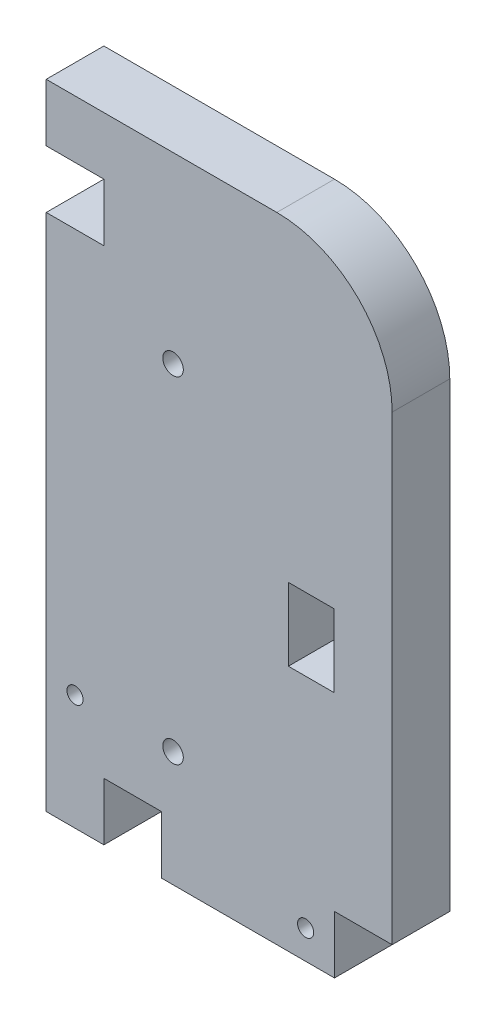
from build123d import *

# Parameters (mm, degrees)
SKETCH1_R           = 1.1303
SKETCH1_R_2         = 0.889
SKETCH1_W           = 5
SKETCH1_H           = 8.000000002
BOSS_EXTRUDE1_DEPTH = 6.35


with BuildPart() as part:
    # Sketch1 → Boss-Extrude1 (new body)
    with BuildSketch(Plane.XY):
        with BuildLine():
            Line((-16.134535362, 9.317270845), (-16.134535362, -47.832729155))
            Line((-16.134535362, -47.832729155), (-9.784535362, -47.832729155))
            Line((-9.784535362, -47.832729155), (-9.784535362, -41.482729155))
            Line((-9.784535362, -41.482729155), (-3.434535362, -41.482729155))
            Line((-3.434535362, -41.482729155), (-3.434535362, -47.832729155))
            Line((-3.434535362, -47.832729155), (15.615464638, -47.832729155))
            Line((15.615464638, -47.832729155), (15.615464638, -41.482729155))
            Line((15.615464638, -41.482729155), (21.965464638, -41.482729155))
            Line((21.965464638, -41.482729155), (21.965464638, 9.317270845))
            ThreePointArc((21.965464638, 9.317270845), (18.245720759, 18.297526966), (9.265464638, 22.017270845))
            Line((9.265464638, 22.017270845), (-16.134535362, 22.017270845))
            Line((-16.134535362, 22.017270845), (-16.134535362, 15.667270845))
            Line((-16.134535362, 15.667270845), (-9.784535362, 15.667270845))
            Line((-9.784535362, 15.667270845), (-9.784535362, 9.317270845))
            Line((-9.784535362, 9.317270845), (-16.134535362, 9.317270845))
        make_face()
        with Locations((-2.164535362, -35.132729155)):
            Circle(SKETCH1_R, mode=Mode.SUBTRACT)
        with Locations((-2.164535362, 1.867270845)):
            Circle(SKETCH1_R, mode=Mode.SUBTRACT)
        with Locations((12.440464638, -44.657729155)):
            Circle(SKETCH1_R_2, mode=Mode.SUBTRACT)
        with Locations((-12.959535362, -35.132729155)):
            Circle(SKETCH1_R_2, mode=Mode.SUBTRACT)
        with Locations((13.035464638, -16.63272908)):
            Rectangle(SKETCH1_W, SKETCH1_H, mode=Mode.SUBTRACT)
    extrude(amount=BOSS_EXTRUDE1_DEPTH)


solid = part.part
